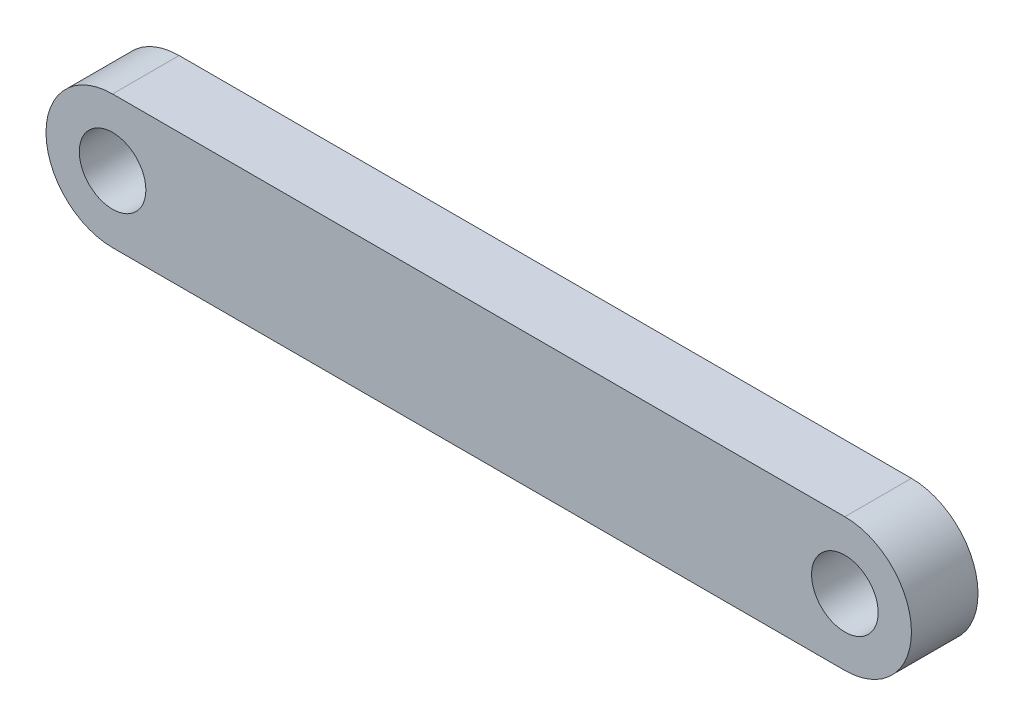
from build123d import *

# Parameters (mm, degrees)
EXTRUDE_1_DEPTH     = 10
SKETCH_2_R          = 5
CUT_EXTRUDE_1_DEPTH = 10
SKETCH_3_R          = 5
CUT_EXTRUDE_2_DEPTH = 10


with BuildPart() as part:
    # 草图1 → 凸台-拉伸1 (new body)
    with BuildSketch(Plane.XY):
        with BuildLine():
            Line((0, -10), (110, -10))
            ThreePointArc((110, -10), (120, 0), (110, 10))
            Line((110, 10), (0, 10))
            ThreePointArc((0, 10), (-10, 0), (0, -10))
        make_face()
    extrude(amount=EXTRUDE_1_DEPTH)

    # 草图2 → 切除-拉伸1 (cut)
    with BuildSketch(Plane.XY.offset(10)):
        Circle(SKETCH_2_R)
    extrude(amount=-CUT_EXTRUDE_1_DEPTH, mode=Mode.SUBTRACT)

    # 草图3 → 切除-拉伸2 (cut)
    with BuildSketch(Plane.XY.offset(10)):
        with Locations((110, 0)):
            Circle(SKETCH_3_R)
    extrude(amount=-CUT_EXTRUDE_2_DEPTH, mode=Mode.SUBTRACT)


solid = part.part
